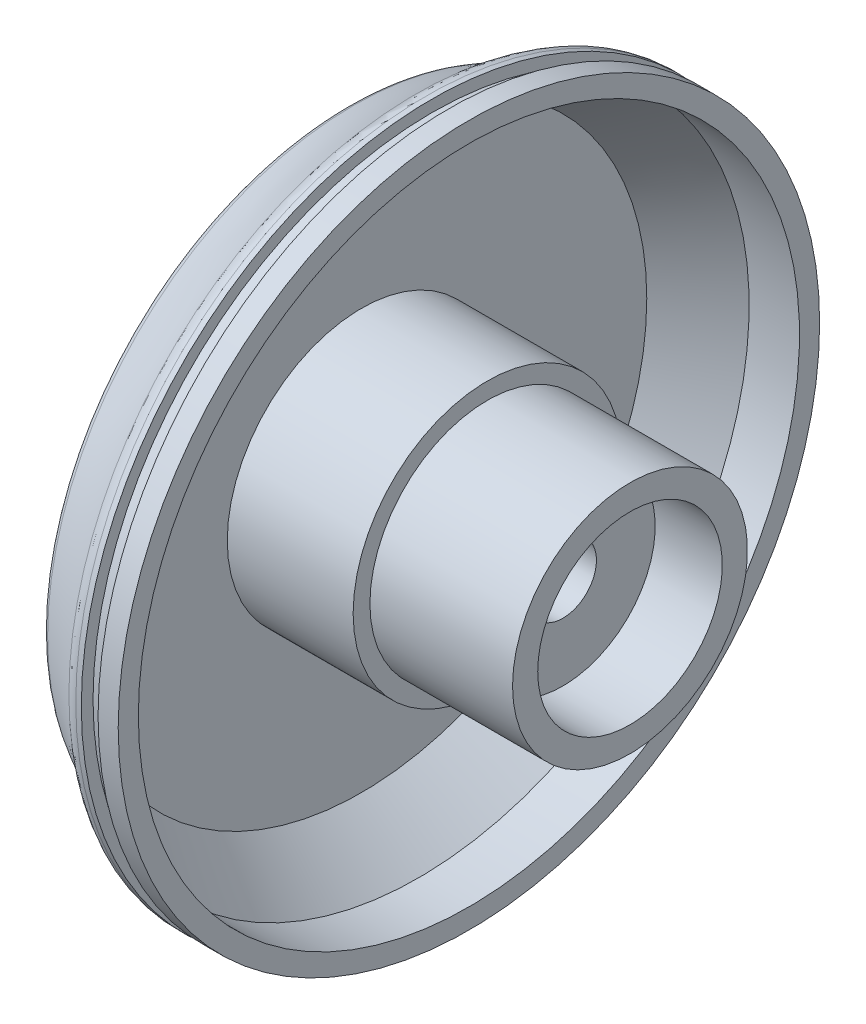
from build123d import *

# Parameters (mm, degrees)
FILLET1_R = 10


with BuildPart() as part:
    # Sketch1 → Revolve1 (revolve)
    with BuildSketch(Plane.XY, mode=Mode.PRIVATE) as revolve1_sk:
        with BuildLine():
            Line((170, 55), (130, 55))
            Line((130, 55), (130, 20))
            Line((130, 20), (40, 20))
            Line((40, 20), (40, 55))
            Line((40, 55), (0, 55))
            Line((0, 55), (0, 180))
            ThreePointArc((0, 180), (23.569740978, 192.840057103), (45, 209))
            Line((45, 209), (52, 209))
            Line((52, 209), (52, 202))
            Line((52, 202), (62, 202))
            Line((62, 202), (62, 209))
            Line((62, 209), (74, 209))
            Line((74, 209), (74, 197))
            Line((74, 197), (44, 197))
            Line((44, 197), (10, 170))
            Line((10, 170), (10, 80))
            Line((10, 80), (85, 80))
            Line((85, 80), (85, 70))
            Line((85, 70), (170, 70))
            Line((170, 70), (170, 55))
        make_face()
    revolve(revolve1_sk.sketch.rotate(Axis((0, 0, 0), (1, 0, 0)), 90), axis=Axis((0, 0, 0), (1, 0, 0)))

    # Fillet1
    fillet1_edges = [part.edges().sort_by_distance(p)[0] for p in [
        (0, 0, -180),
        (45, 0, -209),
    ]]
    fillet(fillet1_edges, radius=FILLET1_R)


solid = part.part
